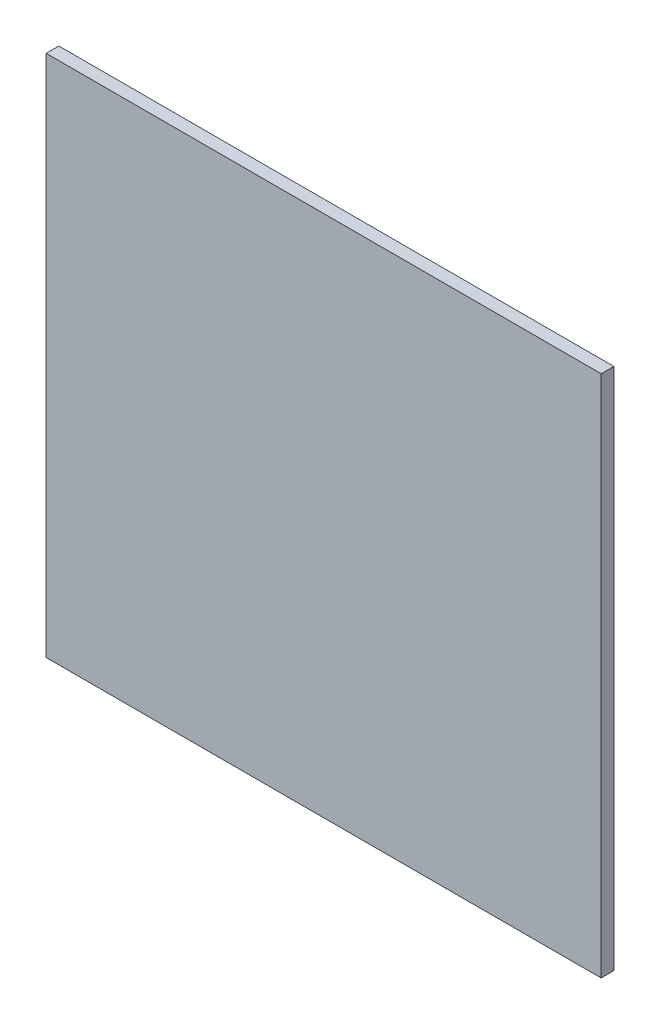
from build123d import *

# Parameters (mm, degrees)
SKETCH1_W           = 70
SKETCH1_H           = 66
BOSS_EXTRUDE1_DEPTH = 1.6


with BuildPart() as part:
    # Sketch1 → Boss-Extrude1 (new body)
    with BuildSketch(Plane.XY):
        with Locations((0.932330588, 29.131620711)):
            Rectangle(SKETCH1_W, SKETCH1_H)
    extrude(amount=BOSS_EXTRUDE1_DEPTH)


solid = part.part
